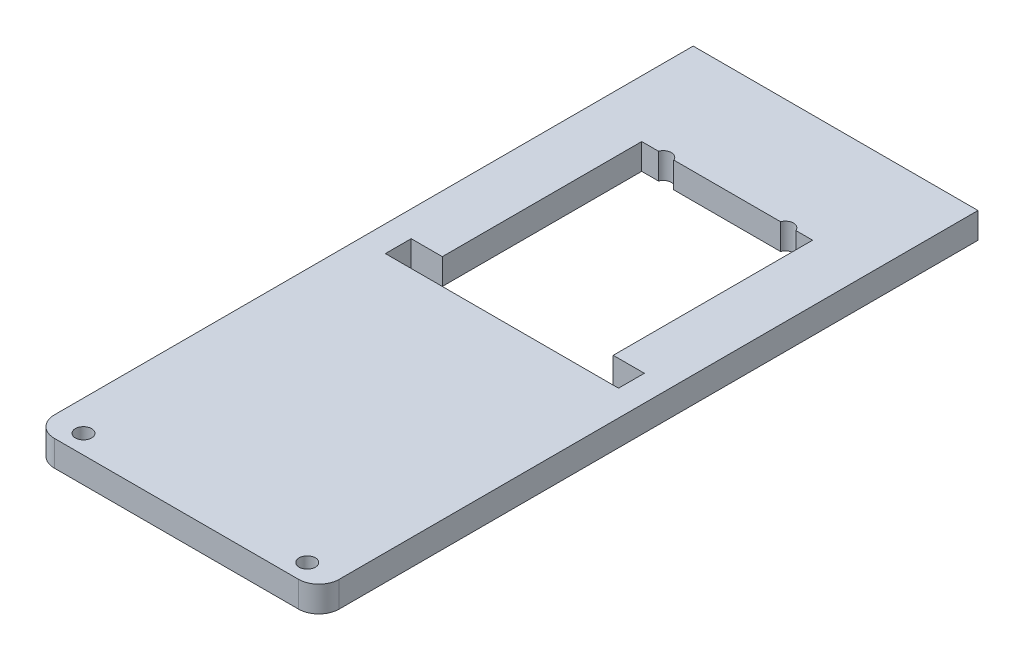
from build123d import *

# Parameters (mm, degrees)
BOSS_EXTRUDE1_DEPTH = 3.175
CUT_EXTRUDE1_DEPTH  = 204.138678001
SKETCH3_W           = 42
SKETCH3_H           = 55.35
SKETCH3_W_2         = 7.65
SKETCH3_H_2         = 6.35
CUT_EXTRUDE2_DEPTH  = 204.138678001
FILLET3_R           = 5
SKETCH5_R           = 2
CUT_EXTRUDE4_DEPTH  = 204.138678001


with BuildPart() as part:
    # Sketch1 → Boss-Extrude1 (new, symmetric)
    with BuildSketch(Plane(origin=(0, 0, 0), x_dir=(1, 0, 0), z_dir=(0, 1, 0))):
        with BuildLine():
            Line((35, -200), (35, 0))
            ThreePointArc((35, 0), (0, 35), (-35, 0))
            Line((-35, 0), (-35, -200))
            Line((-35, -200), (35, -200))
        make_face()
    extrude(amount=BOSS_EXTRUDE1_DEPTH, both=True)

    # Sketch2 → Cut-Extrude1 (cut, through all)
    with BuildSketch(Plane(origin=(0, 3.175, 0), x_dir=(1, 0, 0), z_dir=(0, 1, 0))):
        with BuildLine():
            Line((-35, -38), (35, -38))
            Line((35, -38), (35, 0))
            ThreePointArc((35, 0), (0, 35), (-35, 0))
            Line((-35, 0), (-35, -38))
        make_face()
    extrude(amount=-CUT_EXTRUDE1_DEPTH, mode=Mode.SUBTRACT)

    # Sketch3 → Cut-Extrude2 (cut, through all)
    with BuildSketch(Plane(origin=(0, 3.175, 0), x_dir=(1, 0, 0), z_dir=(0, 1, 0))):
        with Locations((0, -92.325)):
            Rectangle(SKETCH3_W, SKETCH3_H)
        with Locations((-24.825, -116.825)):
            Rectangle(SKETCH3_W_2, SKETCH3_H_2)
        with Locations((24.825, -116.825)):
            Rectangle(SKETCH3_W_2, SKETCH3_H_2)
    extrude(amount=-CUT_EXTRUDE2_DEPTH, mode=Mode.SUBTRACT)

    # Fillet3
    fillet3_edges = [part.edges().sort_by_distance(p)[0] for p in [
        (35, 0, 200),
        (-35, 0, 200),
    ]]
    fillet(fillet3_edges, radius=FILLET3_R)

    # Sketch5 → Cut-Extrude4 (cut, through all)
    with BuildSketch(Plane(origin=(0, 3.175, 0), x_dir=(1, 0, 0), z_dir=(0, 1, 0))):
        with Locations(Location((27.5, -195.35, 0), (0, 0, 270))):
            Circle(SKETCH5_R)
        with Locations(Location((-27.5, -195.35, 0), (0, 0, 270))):
            Circle(SKETCH5_R)
        with Locations((15, -65.35)):
            Circle(SKETCH5_R)
        with Locations((-15, -65.35)):
            Circle(SKETCH5_R)
    extrude(amount=-CUT_EXTRUDE4_DEPTH, mode=Mode.SUBTRACT)


solid = part.part
